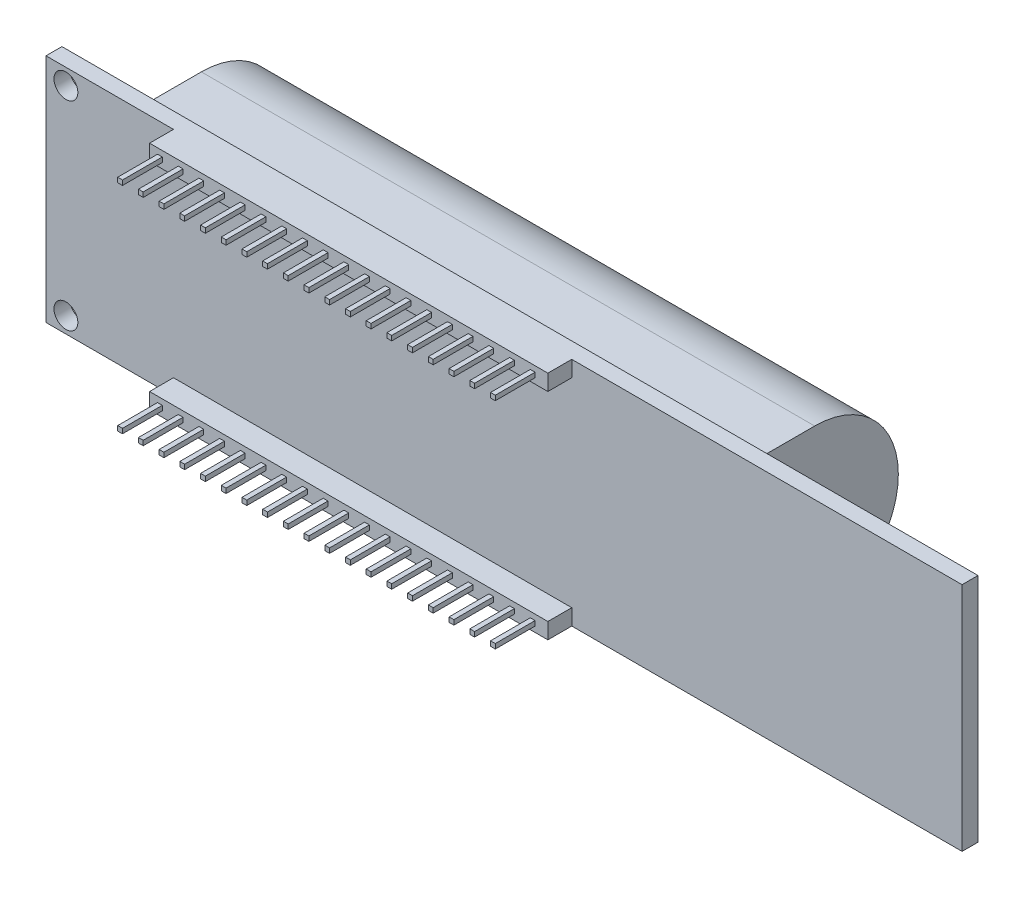
from build123d import *

# Parameters (mm, degrees)
ESQUISSE1_W                = 115
ESQUISSE1_H                = 29
BOSS_EXTRU_1_DEPTH         = 2
ENL_V_MAT_EXTRU_1_REACH    = 61.334
ESQUISSE2_R                = 1.5
ESQUISSE3_W                = 77
ESQUISSE3_H                = 21
BOSS_EXTRU_2_DEPTH         = 10
BOSS_EXTRU_3_DEPTH         = 77
ESQUISSE5_W                = 50
ESQUISSE5_H                = 2
BOSS_EXTRU_4_DEPTH         = 8
ENL_V_MAT_EXTRU_2_REACH    = 69.583
ESQUISSE6_W                = 1
ESQUISSE6_H                = 5
ENL_V_MAT_EXTRU_4_REACH    = 103.164
ESQUISSE8_W                = 5
ESQUISSE8_H                = 0.7
ENL_V_MAT_EXTRU_3_REACH    = 69.583
ESQUISSE7_W                = 2
ESQUISSE7_H                = 5
R_P_TITION_LIN_AIRE1_COUNT = 19
R_P_TITION_LIN_AIRE1_PITCH = 2.6
SYM_TRIE2_COPY_1_REACH     = 69.583
SYM_TRIE2_COPY_1_SKETCH_W  = 2
SYM_TRIE2_COPY_1_SKETCH_H  = 5
SYM_TRIE2_COPY_2_REACH     = 69.583
SYM_TRIE2_COPY_2_SKETCH_W  = 2
SYM_TRIE2_COPY_2_SKETCH_H  = 5
SYM_TRIE2_COPY_3_REACH     = 69.583
SYM_TRIE2_COPY_3_SKETCH_W  = 2
SYM_TRIE2_COPY_3_SKETCH_H  = 5
SYM_TRIE2_COPY_4_REACH     = 69.583
SYM_TRIE2_COPY_4_SKETCH_W  = 2
SYM_TRIE2_COPY_4_SKETCH_H  = 5
SYM_TRIE2_COPY_5_REACH     = 69.583
SYM_TRIE2_COPY_5_SKETCH_W  = 2
SYM_TRIE2_COPY_5_SKETCH_H  = 5
SYM_TRIE2_COPY_6_REACH     = 69.583
SYM_TRIE2_COPY_6_SKETCH_W  = 2
SYM_TRIE2_COPY_6_SKETCH_H  = 5
SYM_TRIE2_COPY_7_REACH     = 69.583
SYM_TRIE2_COPY_7_SKETCH_W  = 2
SYM_TRIE2_COPY_7_SKETCH_H  = 5
SYM_TRIE2_COPY_8_REACH     = 69.583
SYM_TRIE2_COPY_8_SKETCH_W  = 2
SYM_TRIE2_COPY_8_SKETCH_H  = 5
SYM_TRIE2_COPY_9_REACH     = 69.583
SYM_TRIE2_COPY_9_SKETCH_W  = 2
SYM_TRIE2_COPY_9_SKETCH_H  = 5
SYM_TRIE2_COPY_10_REACH    = 69.583
SYM_TRIE2_COPY_10_SKETCH_W = 2
SYM_TRIE2_COPY_10_SKETCH_H = 5
SYM_TRIE2_COPY_11_REACH    = 69.583
SYM_TRIE2_COPY_11_SKETCH_W = 2
SYM_TRIE2_COPY_11_SKETCH_H = 5
SYM_TRIE2_COPY_12_REACH    = 69.583
SYM_TRIE2_COPY_12_SKETCH_W = 2
SYM_TRIE2_COPY_12_SKETCH_H = 5
SYM_TRIE2_COPY_13_REACH    = 69.583
SYM_TRIE2_COPY_13_SKETCH_W = 2
SYM_TRIE2_COPY_13_SKETCH_H = 5
SYM_TRIE2_COPY_14_REACH    = 69.583
SYM_TRIE2_COPY_14_SKETCH_W = 2
SYM_TRIE2_COPY_14_SKETCH_H = 5
SYM_TRIE2_COPY_15_REACH    = 69.583
SYM_TRIE2_COPY_15_SKETCH_W = 2
SYM_TRIE2_COPY_15_SKETCH_H = 5
SYM_TRIE2_COPY_16_REACH    = 69.583
SYM_TRIE2_COPY_16_SKETCH_W = 2
SYM_TRIE2_COPY_16_SKETCH_H = 5
SYM_TRIE2_COPY_17_REACH    = 69.583
SYM_TRIE2_COPY_17_SKETCH_W = 2
SYM_TRIE2_COPY_17_SKETCH_H = 5
SYM_TRIE2_COPY_18_REACH    = 69.583
SYM_TRIE2_COPY_18_SKETCH_W = 2
SYM_TRIE2_COPY_18_SKETCH_H = 5


with BuildPart() as part:
    # Esquisse1 → Boss.-Extru.1 (new body)
    with BuildSketch(Plane.XY):
        Rectangle(ESQUISSE1_W, ESQUISSE1_H)
    extrude(amount=BOSS_EXTRU_1_DEPTH)

    # Esquisse2 → Enlèv. mat.-Extru.1 (cut, up to next)
    with BuildSketch(Plane(origin=(0, 0, 0), x_dir=(-1, 0, 0), z_dir=(0, 0, -1)), mode=Mode.PRIVATE) as enl_v_mat_extru_1_sk1:
        with Locations((55, 12.5)):
            Circle(ESQUISSE2_R)
    enl_v_mat_extru_1_tool1 = extrude(enl_v_mat_extru_1_sk1.sketch, amount=-ENL_V_MAT_EXTRU_1_REACH, mode=Mode.PRIVATE) & part.part
    enl_v_mat_extru_1 = enl_v_mat_extru_1_tool1.solids().sort_by_distance((-55, 12.5, 0))[0]
    add(enl_v_mat_extru_1, mode=Mode.SUBTRACT)

    # Symétrie1: Enlèv. mat.-Extru.1 across plane
    add(enl_v_mat_extru_1.mirror(Plane.ZX), mode=Mode.SUBTRACT)

    # Esquisse3 → Boss.-Extru.2 (add)
    with BuildSketch(Plane(origin=(0, 0, 0), x_dir=(-1, 0, 0), z_dir=(0, 0, -1))):
        with Locations((11.5, 0)):
            Rectangle(ESQUISSE3_W, ESQUISSE3_H)
    extrude(amount=BOSS_EXTRU_2_DEPTH)

    # Esquisse4 → Boss.-Extru.3 (add)
    with BuildSketch(Plane(origin=(27, 0, 0), x_dir=(0, 0, -1), z_dir=(1, 0, 0))):
        with BuildLine():
            Line((10, 10.5), (10, -10.5))
            ThreePointArc((10, -10.5), (20.5, 0), (10, 10.5))
        make_face()
    extrude(amount=-BOSS_EXTRU_3_DEPTH)

    # Esquisse5 → Boss.-Extru.4 (add)
    with BuildSketch(Plane.XY.offset(2)):
        with Locations((-16.498298324, 13.5)):
            Rectangle(ESQUISSE5_W, ESQUISSE5_H)
    boss_extru_4 = extrude(amount=BOSS_EXTRU_4_DEPTH)

    # Esquisse6 → Enlèv. mat.-Extru.2 (cut, up to next)
    with BuildSketch(Plane(origin=(0, 14.5, 0), x_dir=(1, 0, 0), z_dir=(0, 1, 0)), mode=Mode.PRIVATE) as enl_v_mat_extru_2_sk1:
        with Locations((-40.998298324, -7.5)):
            Rectangle(ESQUISSE6_W, ESQUISSE6_H)
    enl_v_mat_extru_2_tool1 = extrude(enl_v_mat_extru_2_sk1.sketch, amount=-ENL_V_MAT_EXTRU_2_REACH, mode=Mode.PRIVATE) & part.part
    enl_v_mat_extru_2 = enl_v_mat_extru_2_tool1.solids().sort_by_distance((-40.998298, 14.5, 7.5))[0]
    add(enl_v_mat_extru_2, mode=Mode.SUBTRACT)

    # Esquisse8 → Enlèv. mat.-Extru.4 (cut, up to next)
    with BuildSketch(Plane.ZY.offset(40.498298324), mode=Mode.PRIVATE) as enl_v_mat_extru_4_sk1:
        with Locations((7.5, 14.15)):
            Rectangle(ESQUISSE8_W, ESQUISSE8_H)
    enl_v_mat_extru_4_tool1 = extrude(enl_v_mat_extru_4_sk1.sketch, amount=-ENL_V_MAT_EXTRU_4_REACH, mode=Mode.PRIVATE) & part.part
    # Esquisse8 → Enlèv. mat.-Extru.4 (cut, up to next)
    with BuildSketch(Plane.ZY.offset(40.498298324), mode=Mode.PRIVATE) as enl_v_mat_extru_4_sk2:
        with Locations((7.5, 12.85)):
            Rectangle(ESQUISSE8_W, ESQUISSE8_H)
    enl_v_mat_extru_4_tool2 = extrude(enl_v_mat_extru_4_sk2.sketch, amount=-ENL_V_MAT_EXTRU_4_REACH, mode=Mode.PRIVATE) & part.part
    enl_v_mat_extru_4_1 = enl_v_mat_extru_4_tool1.solids().sort_by_distance((-40.498298, 14.15, 7.5))[0]
    add(enl_v_mat_extru_4_1, mode=Mode.SUBTRACT)
    enl_v_mat_extru_4_2 = enl_v_mat_extru_4_tool2.solids().sort_by_distance((-40.498298, 12.85, 7.5))[0]
    add(enl_v_mat_extru_4_2, mode=Mode.SUBTRACT)
    enl_v_mat_extru_4 = enl_v_mat_extru_4_1 + enl_v_mat_extru_4_2  # Enlèv. mat.-Extru.4 as one shape, for the pattern or mirror that repeats it

    # Esquisse7 → Enlèv. mat.-Extru.3 (cut, up to next)
    with BuildSketch(Plane(origin=(0, 14.5, 0), x_dir=(1, 0, 0), z_dir=(0, 1, 0)), mode=Mode.PRIVATE) as enl_v_mat_extru_3_sk1:
        with Locations((-38.898298324, -7.5)):
            Rectangle(ESQUISSE7_W, ESQUISSE7_H)
    enl_v_mat_extru_3_tool1 = extrude(enl_v_mat_extru_3_sk1.sketch, amount=-ENL_V_MAT_EXTRU_3_REACH, mode=Mode.PRIVATE) & part.part
    enl_v_mat_extru_3 = enl_v_mat_extru_3_tool1.solids().sort_by_distance((-38.898298, 14.5, 7.5))[0]
    add(enl_v_mat_extru_3, mode=Mode.SUBTRACT)

    # Répétition linéaire1: Enlèv. mat.-Extru.3 ×19
    with Locations(*[(i * R_P_TITION_LIN_AIRE1_PITCH, 0, 0) for i in range(1, R_P_TITION_LIN_AIRE1_COUNT)]):
        add(enl_v_mat_extru_3, mode=Mode.SUBTRACT)

    # Symétrie2: Boss.-Extru.4, Enlèv. mat.-Extru.2, Enlèv. mat.-Extru.4, Enlèv. mat.-Extru.3 across plane
    add(boss_extru_4.mirror(Plane.ZX))
    add(enl_v_mat_extru_2.mirror(Plane.ZX), mode=Mode.SUBTRACT)
    add(enl_v_mat_extru_4.mirror(Plane.ZX), mode=Mode.SUBTRACT)
    add(enl_v_mat_extru_3.mirror(Plane.ZX), mode=Mode.SUBTRACT)

    # Symétrie2 copy 1 sketch → Symétrie2 copy 1 (cut, up to next)
    with BuildSketch(Plane(origin=(2.6, -14.5, 0), x_dir=(1, 0, 0), z_dir=(0, -1, 0)), mode=Mode.PRIVATE) as sym_trie2_copy_1_sk1:
        with Locations((-38.898298324, 7.5)):
            Rectangle(SYM_TRIE2_COPY_1_SKETCH_W, SYM_TRIE2_COPY_1_SKETCH_H)
    sym_trie2_copy_1_tool1 = extrude(sym_trie2_copy_1_sk1.sketch, amount=-SYM_TRIE2_COPY_1_REACH, mode=Mode.PRIVATE) & part.part
    add(sym_trie2_copy_1_tool1.solids().sort_by_distance((-36.298298, -14.5, 7.5))[0], mode=Mode.SUBTRACT)

    # Symétrie2 copy 2 sketch → Symétrie2 copy 2 (cut, up to next)
    with BuildSketch(Plane(origin=(5.2, -14.5, 0), x_dir=(1, 0, 0), z_dir=(0, -1, 0)), mode=Mode.PRIVATE) as sym_trie2_copy_2_sk1:
        with Locations((-38.898298324, 7.5)):
            Rectangle(SYM_TRIE2_COPY_2_SKETCH_W, SYM_TRIE2_COPY_2_SKETCH_H)
    sym_trie2_copy_2_tool1 = extrude(sym_trie2_copy_2_sk1.sketch, amount=-SYM_TRIE2_COPY_2_REACH, mode=Mode.PRIVATE) & part.part
    add(sym_trie2_copy_2_tool1.solids().sort_by_distance((-33.698298, -14.5, 7.5))[0], mode=Mode.SUBTRACT)

    # Symétrie2 copy 3 sketch → Symétrie2 copy 3 (cut, up to next)
    with BuildSketch(Plane(origin=(7.8, -14.5, 0), x_dir=(1, 0, 0), z_dir=(0, -1, 0)), mode=Mode.PRIVATE) as sym_trie2_copy_3_sk1:
        with Locations((-38.898298324, 7.5)):
            Rectangle(SYM_TRIE2_COPY_3_SKETCH_W, SYM_TRIE2_COPY_3_SKETCH_H)
    sym_trie2_copy_3_tool1 = extrude(sym_trie2_copy_3_sk1.sketch, amount=-SYM_TRIE2_COPY_3_REACH, mode=Mode.PRIVATE) & part.part
    add(sym_trie2_copy_3_tool1.solids().sort_by_distance((-31.098298, -14.5, 7.5))[0], mode=Mode.SUBTRACT)

    # Symétrie2 copy 4 sketch → Symétrie2 copy 4 (cut, up to next)
    with BuildSketch(Plane(origin=(10.4, -14.5, 0), x_dir=(1, 0, 0), z_dir=(0, -1, 0)), mode=Mode.PRIVATE) as sym_trie2_copy_4_sk1:
        with Locations((-38.898298324, 7.5)):
            Rectangle(SYM_TRIE2_COPY_4_SKETCH_W, SYM_TRIE2_COPY_4_SKETCH_H)
    sym_trie2_copy_4_tool1 = extrude(sym_trie2_copy_4_sk1.sketch, amount=-SYM_TRIE2_COPY_4_REACH, mode=Mode.PRIVATE) & part.part
    add(sym_trie2_copy_4_tool1.solids().sort_by_distance((-28.498298, -14.5, 7.5))[0], mode=Mode.SUBTRACT)

    # Symétrie2 copy 5 sketch → Symétrie2 copy 5 (cut, up to next)
    with BuildSketch(Plane(origin=(13, -14.5, 0), x_dir=(1, 0, 0), z_dir=(0, -1, 0)), mode=Mode.PRIVATE) as sym_trie2_copy_5_sk1:
        with Locations((-38.898298324, 7.5)):
            Rectangle(SYM_TRIE2_COPY_5_SKETCH_W, SYM_TRIE2_COPY_5_SKETCH_H)
    sym_trie2_copy_5_tool1 = extrude(sym_trie2_copy_5_sk1.sketch, amount=-SYM_TRIE2_COPY_5_REACH, mode=Mode.PRIVATE) & part.part
    add(sym_trie2_copy_5_tool1.solids().sort_by_distance((-25.898298, -14.5, 7.5))[0], mode=Mode.SUBTRACT)

    # Symétrie2 copy 6 sketch → Symétrie2 copy 6 (cut, up to next)
    with BuildSketch(Plane(origin=(15.6, -14.5, 0), x_dir=(1, 0, 0), z_dir=(0, -1, 0)), mode=Mode.PRIVATE) as sym_trie2_copy_6_sk1:
        with Locations((-38.898298324, 7.5)):
            Rectangle(SYM_TRIE2_COPY_6_SKETCH_W, SYM_TRIE2_COPY_6_SKETCH_H)
    sym_trie2_copy_6_tool1 = extrude(sym_trie2_copy_6_sk1.sketch, amount=-SYM_TRIE2_COPY_6_REACH, mode=Mode.PRIVATE) & part.part
    add(sym_trie2_copy_6_tool1.solids().sort_by_distance((-23.298298, -14.5, 7.5))[0], mode=Mode.SUBTRACT)

    # Symétrie2 copy 7 sketch → Symétrie2 copy 7 (cut, up to next)
    with BuildSketch(Plane(origin=(18.2, -14.5, 0), x_dir=(1, 0, 0), z_dir=(0, -1, 0)), mode=Mode.PRIVATE) as sym_trie2_copy_7_sk1:
        with Locations((-38.898298324, 7.5)):
            Rectangle(SYM_TRIE2_COPY_7_SKETCH_W, SYM_TRIE2_COPY_7_SKETCH_H)
    sym_trie2_copy_7_tool1 = extrude(sym_trie2_copy_7_sk1.sketch, amount=-SYM_TRIE2_COPY_7_REACH, mode=Mode.PRIVATE) & part.part
    add(sym_trie2_copy_7_tool1.solids().sort_by_distance((-20.698298, -14.5, 7.5))[0], mode=Mode.SUBTRACT)

    # Symétrie2 copy 8 sketch → Symétrie2 copy 8 (cut, up to next)
    with BuildSketch(Plane(origin=(20.8, -14.5, 0), x_dir=(1, 0, 0), z_dir=(0, -1, 0)), mode=Mode.PRIVATE) as sym_trie2_copy_8_sk1:
        with Locations((-38.898298324, 7.5)):
            Rectangle(SYM_TRIE2_COPY_8_SKETCH_W, SYM_TRIE2_COPY_8_SKETCH_H)
    sym_trie2_copy_8_tool1 = extrude(sym_trie2_copy_8_sk1.sketch, amount=-SYM_TRIE2_COPY_8_REACH, mode=Mode.PRIVATE) & part.part
    add(sym_trie2_copy_8_tool1.solids().sort_by_distance((-18.098298, -14.5, 7.5))[0], mode=Mode.SUBTRACT)

    # Symétrie2 copy 9 sketch → Symétrie2 copy 9 (cut, up to next)
    with BuildSketch(Plane(origin=(23.4, -14.5, 0), x_dir=(1, 0, 0), z_dir=(0, -1, 0)), mode=Mode.PRIVATE) as sym_trie2_copy_9_sk1:
        with Locations((-38.898298324, 7.5)):
            Rectangle(SYM_TRIE2_COPY_9_SKETCH_W, SYM_TRIE2_COPY_9_SKETCH_H)
    sym_trie2_copy_9_tool1 = extrude(sym_trie2_copy_9_sk1.sketch, amount=-SYM_TRIE2_COPY_9_REACH, mode=Mode.PRIVATE) & part.part
    add(sym_trie2_copy_9_tool1.solids().sort_by_distance((-15.498298, -14.5, 7.5))[0], mode=Mode.SUBTRACT)

    # Symétrie2 copy 10 sketch → Symétrie2 copy 10 (cut, up to next)
    with BuildSketch(Plane(origin=(26, -14.5, 0), x_dir=(1, 0, 0), z_dir=(0, -1, 0)), mode=Mode.PRIVATE) as sym_trie2_copy_10_sk1:
        with Locations((-38.898298324, 7.5)):
            Rectangle(SYM_TRIE2_COPY_10_SKETCH_W, SYM_TRIE2_COPY_10_SKETCH_H)
    sym_trie2_copy_10_tool1 = extrude(sym_trie2_copy_10_sk1.sketch, amount=-SYM_TRIE2_COPY_10_REACH, mode=Mode.PRIVATE) & part.part
    add(sym_trie2_copy_10_tool1.solids().sort_by_distance((-12.898298, -14.5, 7.5))[0], mode=Mode.SUBTRACT)

    # Symétrie2 copy 11 sketch → Symétrie2 copy 11 (cut, up to next)
    with BuildSketch(Plane(origin=(28.6, -14.5, 0), x_dir=(1, 0, 0), z_dir=(0, -1, 0)), mode=Mode.PRIVATE) as sym_trie2_copy_11_sk1:
        with Locations((-38.898298324, 7.5)):
            Rectangle(SYM_TRIE2_COPY_11_SKETCH_W, SYM_TRIE2_COPY_11_SKETCH_H)
    sym_trie2_copy_11_tool1 = extrude(sym_trie2_copy_11_sk1.sketch, amount=-SYM_TRIE2_COPY_11_REACH, mode=Mode.PRIVATE) & part.part
    add(sym_trie2_copy_11_tool1.solids().sort_by_distance((-10.298298, -14.5, 7.5))[0], mode=Mode.SUBTRACT)

    # Symétrie2 copy 12 sketch → Symétrie2 copy 12 (cut, up to next)
    with BuildSketch(Plane(origin=(31.2, -14.5, 0), x_dir=(1, 0, 0), z_dir=(0, -1, 0)), mode=Mode.PRIVATE) as sym_trie2_copy_12_sk1:
        with Locations((-38.898298324, 7.5)):
            Rectangle(SYM_TRIE2_COPY_12_SKETCH_W, SYM_TRIE2_COPY_12_SKETCH_H)
    sym_trie2_copy_12_tool1 = extrude(sym_trie2_copy_12_sk1.sketch, amount=-SYM_TRIE2_COPY_12_REACH, mode=Mode.PRIVATE) & part.part
    add(sym_trie2_copy_12_tool1.solids().sort_by_distance((-7.698298, -14.5, 7.5))[0], mode=Mode.SUBTRACT)

    # Symétrie2 copy 13 sketch → Symétrie2 copy 13 (cut, up to next)
    with BuildSketch(Plane(origin=(33.8, -14.5, 0), x_dir=(1, 0, 0), z_dir=(0, -1, 0)), mode=Mode.PRIVATE) as sym_trie2_copy_13_sk1:
        with Locations((-38.898298324, 7.5)):
            Rectangle(SYM_TRIE2_COPY_13_SKETCH_W, SYM_TRIE2_COPY_13_SKETCH_H)
    sym_trie2_copy_13_tool1 = extrude(sym_trie2_copy_13_sk1.sketch, amount=-SYM_TRIE2_COPY_13_REACH, mode=Mode.PRIVATE) & part.part
    add(sym_trie2_copy_13_tool1.solids().sort_by_distance((-5.098298, -14.5, 7.5))[0], mode=Mode.SUBTRACT)

    # Symétrie2 copy 14 sketch → Symétrie2 copy 14 (cut, up to next)
    with BuildSketch(Plane(origin=(36.4, -14.5, 0), x_dir=(1, 0, 0), z_dir=(0, -1, 0)), mode=Mode.PRIVATE) as sym_trie2_copy_14_sk1:
        with Locations((-38.898298324, 7.5)):
            Rectangle(SYM_TRIE2_COPY_14_SKETCH_W, SYM_TRIE2_COPY_14_SKETCH_H)
    sym_trie2_copy_14_tool1 = extrude(sym_trie2_copy_14_sk1.sketch, amount=-SYM_TRIE2_COPY_14_REACH, mode=Mode.PRIVATE) & part.part
    add(sym_trie2_copy_14_tool1.solids().sort_by_distance((-2.498298, -14.5, 7.5))[0], mode=Mode.SUBTRACT)

    # Symétrie2 copy 15 sketch → Symétrie2 copy 15 (cut, up to next)
    with BuildSketch(Plane(origin=(39, -14.5, 0), x_dir=(1, 0, 0), z_dir=(0, -1, 0)), mode=Mode.PRIVATE) as sym_trie2_copy_15_sk1:
        with Locations((-38.898298324, 7.5)):
            Rectangle(SYM_TRIE2_COPY_15_SKETCH_W, SYM_TRIE2_COPY_15_SKETCH_H)
    sym_trie2_copy_15_tool1 = extrude(sym_trie2_copy_15_sk1.sketch, amount=-SYM_TRIE2_COPY_15_REACH, mode=Mode.PRIVATE) & part.part
    add(sym_trie2_copy_15_tool1.solids().sort_by_distance((0.101702, -14.5, 7.5))[0], mode=Mode.SUBTRACT)

    # Symétrie2 copy 16 sketch → Symétrie2 copy 16 (cut, up to next)
    with BuildSketch(Plane(origin=(41.6, -14.5, 0), x_dir=(1, 0, 0), z_dir=(0, -1, 0)), mode=Mode.PRIVATE) as sym_trie2_copy_16_sk1:
        with Locations((-38.898298324, 7.5)):
            Rectangle(SYM_TRIE2_COPY_16_SKETCH_W, SYM_TRIE2_COPY_16_SKETCH_H)
    sym_trie2_copy_16_tool1 = extrude(sym_trie2_copy_16_sk1.sketch, amount=-SYM_TRIE2_COPY_16_REACH, mode=Mode.PRIVATE) & part.part
    add(sym_trie2_copy_16_tool1.solids().sort_by_distance((2.701702, -14.5, 7.5))[0], mode=Mode.SUBTRACT)

    # Symétrie2 copy 17 sketch → Symétrie2 copy 17 (cut, up to next)
    with BuildSketch(Plane(origin=(44.2, -14.5, 0), x_dir=(1, 0, 0), z_dir=(0, -1, 0)), mode=Mode.PRIVATE) as sym_trie2_copy_17_sk1:
        with Locations((-38.898298324, 7.5)):
            Rectangle(SYM_TRIE2_COPY_17_SKETCH_W, SYM_TRIE2_COPY_17_SKETCH_H)
    sym_trie2_copy_17_tool1 = extrude(sym_trie2_copy_17_sk1.sketch, amount=-SYM_TRIE2_COPY_17_REACH, mode=Mode.PRIVATE) & part.part
    add(sym_trie2_copy_17_tool1.solids().sort_by_distance((5.301702, -14.5, 7.5))[0], mode=Mode.SUBTRACT)

    # Symétrie2 copy 18 sketch → Symétrie2 copy 18 (cut, up to next)
    with BuildSketch(Plane(origin=(46.8, -14.5, 0), x_dir=(1, 0, 0), z_dir=(0, -1, 0)), mode=Mode.PRIVATE) as sym_trie2_copy_18_sk1:
        with Locations((-38.898298324, 7.5)):
            Rectangle(SYM_TRIE2_COPY_18_SKETCH_W, SYM_TRIE2_COPY_18_SKETCH_H)
    sym_trie2_copy_18_tool1 = extrude(sym_trie2_copy_18_sk1.sketch, amount=-SYM_TRIE2_COPY_18_REACH, mode=Mode.PRIVATE) & part.part
    add(sym_trie2_copy_18_tool1.solids().sort_by_distance((7.901702, -14.5, 7.5))[0], mode=Mode.SUBTRACT)


solid = part.part
